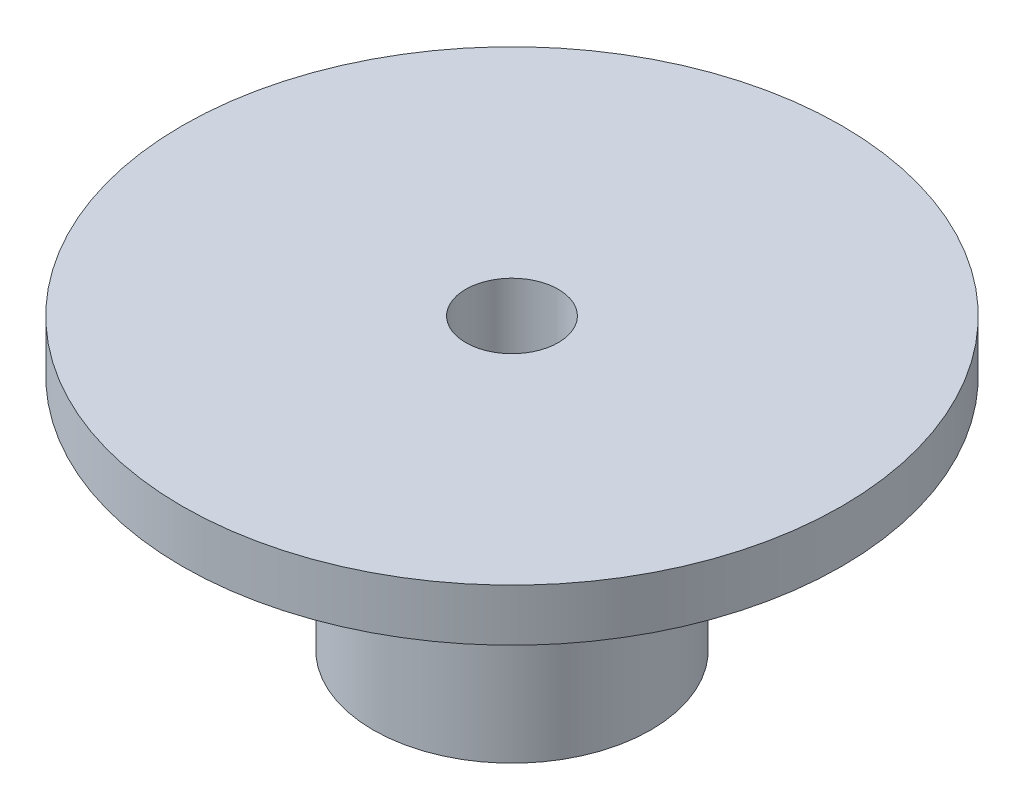
from build123d import *

# Parameters (mm, degrees)
SKETCH2_R           = 28.5
SKETCH2_R_2         = 4
BOSS_EXTRUDE1_DEPTH = 25
SKETCH4_OUTSIDE_W   = 75.88
SKETCH4_OUTSIDE_H   = 75.88
SKETCH4_OUTSIDE_R   = 12
CUT_EXTRUDE2_DEPTH  = 20.5


with BuildPart() as part:
    # Sketch2 → Boss-Extrude1 (new body)
    with BuildSketch(Plane(origin=(0, 0, 0), x_dir=(1, 0, 0), z_dir=(0, 1, 0))):
        with Locations(Location((0, 0, 0), (0, 0, 270))):
            Circle(SKETCH2_R)
        with Locations(Location((0, 0, 0), (0, 0, 270))):
            Circle(SKETCH2_R_2, mode=Mode.SUBTRACT)
    extrude(amount=BOSS_EXTRUDE1_DEPTH)

    # Sketch4 outside → Cut-Extrude2 (cut)
    with BuildSketch(Plane.XZ):
        Rectangle(SKETCH4_OUTSIDE_W, SKETCH4_OUTSIDE_H)
        with Locations(Location((0, 0, 0), (0, 0, 270))):
            Circle(SKETCH4_OUTSIDE_R, mode=Mode.SUBTRACT)
    extrude(amount=-CUT_EXTRUDE2_DEPTH, mode=Mode.SUBTRACT)


solid = part.part
